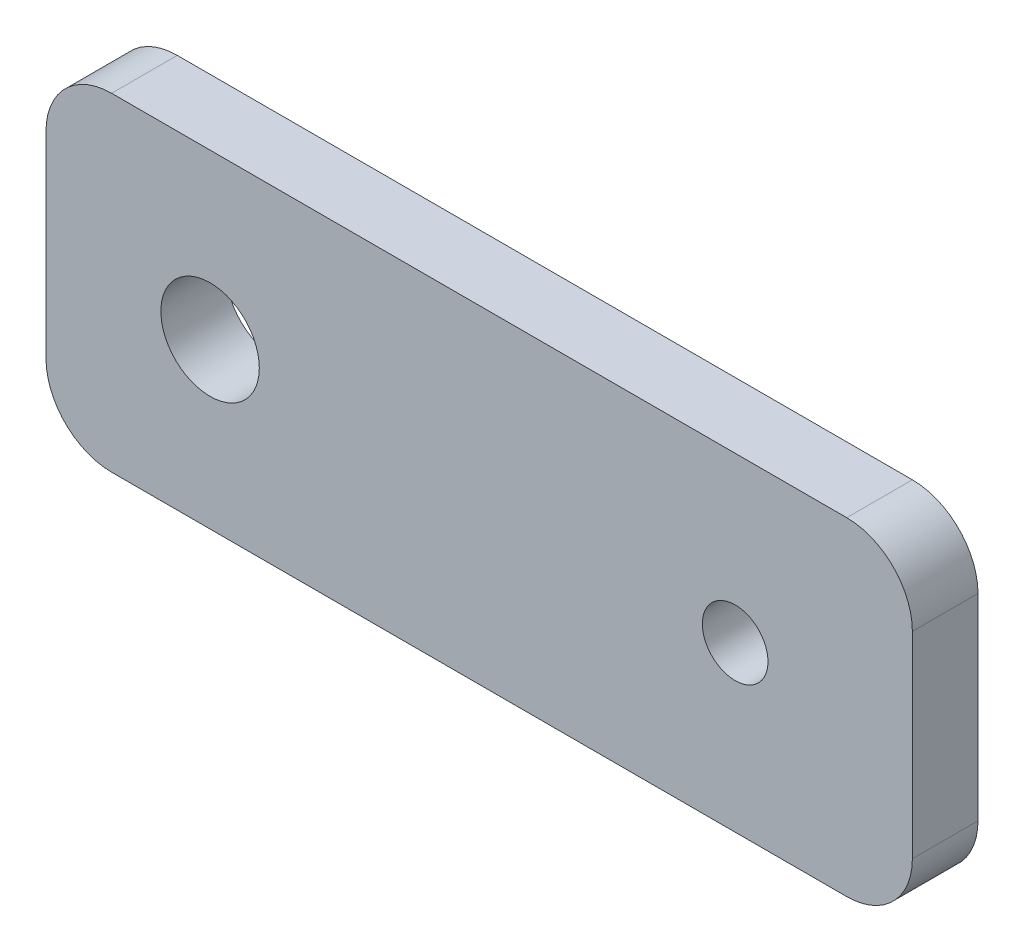
from build123d import *

# Parameters (mm, degrees)
SKETCH1_W           = 33.528
SKETCH1_H           = 12.7
BOSS_EXTRUDE1_DEPTH = 2.54
FILLET1_R           = 2.54
SKETCH2_R           = 1.905
SKETCH2_R_2         = 1.27
CUT_EXTRUDE1_DEPTH  = 36.942570637


with BuildPart() as part:
    # Sketch1 → Boss-Extrude1 (new body)
    with BuildSketch(Plane.XY):
        with Locations((-16.764, 6.35)):
            Rectangle(SKETCH1_W, SKETCH1_H)
    extrude(amount=BOSS_EXTRUDE1_DEPTH)

    # Fillet1
    fillet1_edges = [part.edges().sort_by_distance(p)[0] for p in [
        (0, 0, 1.27),
        (-33.528, 0, 1.27),
        (-33.528, 12.7, 1.27),
        (0, 12.7, 1.27),
    ]]
    fillet(fillet1_edges, radius=FILLET1_R)

    # Sketch2 → Cut-Extrude1 (cut, through all)
    with BuildSketch(Plane.XY.offset(2.54)):
        with Locations((-27.178, 6.35)):
            Circle(SKETCH2_R)
        with Locations((-6.858, 6.35)):
            Circle(SKETCH2_R_2)
    extrude(amount=-CUT_EXTRUDE1_DEPTH, mode=Mode.SUBTRACT)


solid = part.part
